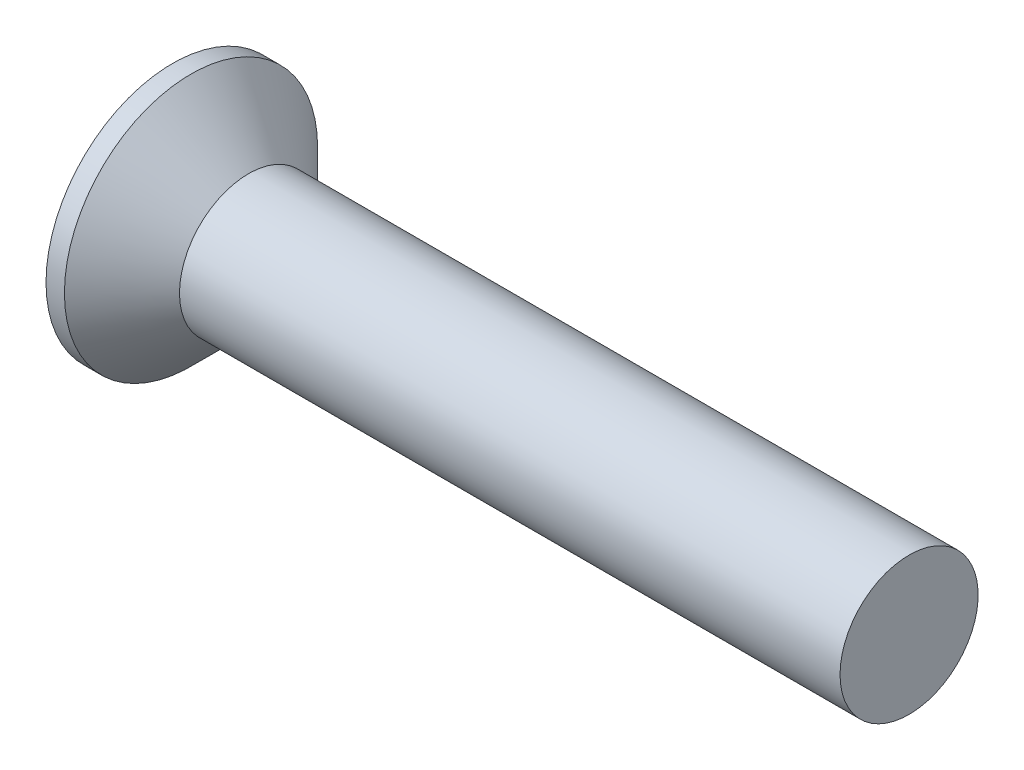
from build123d import *


with BuildPart() as part:
    # Esquisse1 → Révolution1 (revolve)
    with BuildSketch(Plane.XY, mode=Mode.PRIVATE) as r_volution1_sk:
        Polygon((0, 0), (16, 0), (16, 1.5), (1.65, 1.5), (0.4, 2.75), (0, 2.75), align=None)
    revolve(r_volution1_sk.sketch.rotate(Axis((0, 0, 0), (1, 0, 0)), 90), axis=Axis((0, 0, 0), (1, 0, 0)))


solid = part.part
